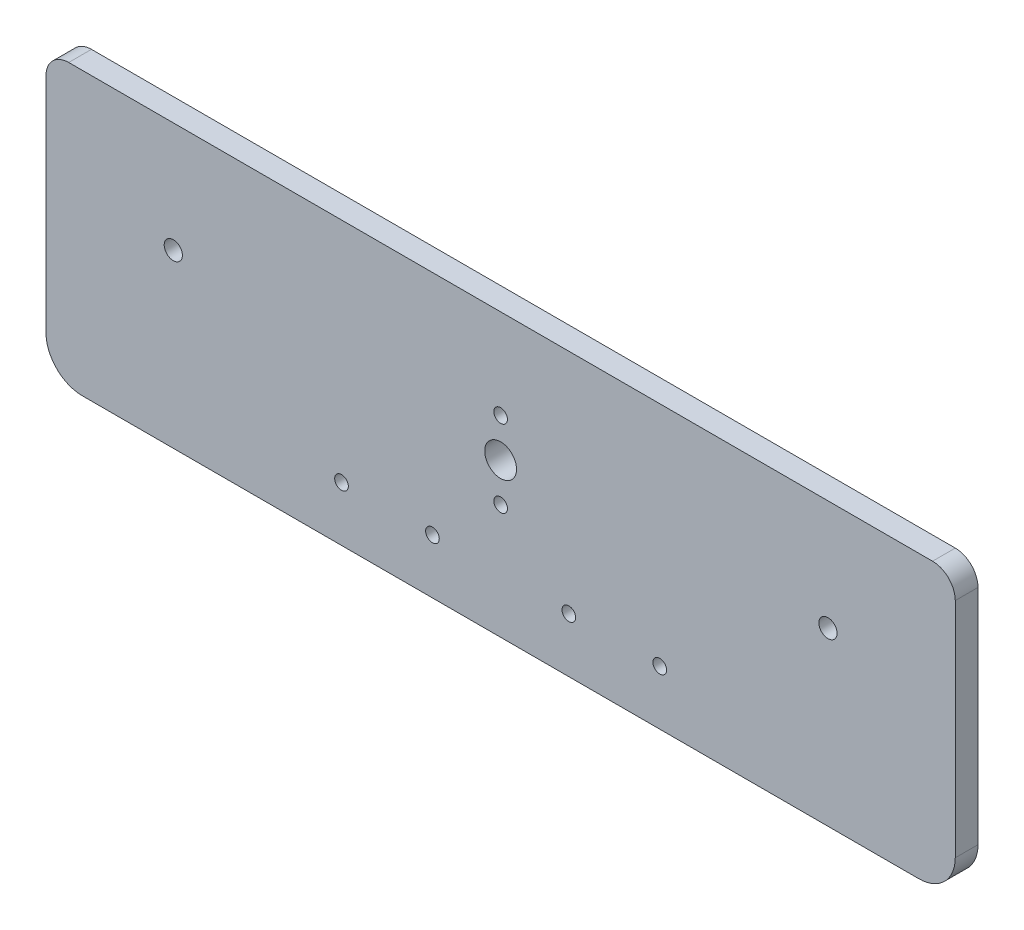
from build123d import *

# Parameters (mm, degrees)
CROQUIS1_R              = 1.5
CROQUIS1_R_2            = 2
CROQUIS1_R_3            = 3.5
SALIENTE_EXTRUIR1_DEPTH = 5
REDONDEO1_R             = 5
CROQUIS2_R              = 1.5
CORTAR_EXTRUIR1_DEPTH   = 116.212846506


with BuildPart() as part:
    # Croquis1 → Saliente-Extruir1 (new body)
    with BuildSketch(Plane.XY):
        with BuildLine():
            Line((100, -49), (100, 0))
            Line((100, 0), (100, 5))
            Line((100, 5), (-100, 5))
            Line((-100, 5), (-100, 0))
            Line((-100, 0), (-100, -49))
            ThreePointArc((-100, -49), (-97.656854249, -54.656854249), (-92, -57))
            Line((-92, -57), (92, -57))
            ThreePointArc((92, -57), (97.656854249, -54.656854249), (100, -49))
        make_face()
        with Locations((-35, -45)):
            Circle(CROQUIS1_R, mode=Mode.SUBTRACT)
        with Locations((-15, -45)):
            Circle(CROQUIS1_R, mode=Mode.SUBTRACT)
        with Locations((15, -45)):
            Circle(CROQUIS1_R, mode=Mode.SUBTRACT)
        with Locations((35, -45)):
            Circle(CROQUIS1_R, mode=Mode.SUBTRACT)
        with Locations((-72, -19.25)):
            Circle(CROQUIS1_R_2, mode=Mode.SUBTRACT)
        with Locations((0, -23.25)):
            Circle(CROQUIS1_R_3, mode=Mode.SUBTRACT)
        with Locations((72, -19.25)):
            Circle(CROQUIS1_R_2, mode=Mode.SUBTRACT)
    extrude(amount=SALIENTE_EXTRUIR1_DEPTH)

    # Redondeo1
    redondeo1_edges = [part.edges().sort_by_distance(p)[0] for p in [
        (-100, 5, 2.5),
        (100, 5, 2.5),
    ]]
    fillet(redondeo1_edges, radius=REDONDEO1_R)

    # Croquis2 → Cortar-Extruir1 (cut, through all)
    with BuildSketch(Plane.XY.offset(5)):
        with Locations((0, -14.75)):
            Circle(CROQUIS2_R)
        with Locations((0, -31.75)):
            Circle(CROQUIS2_R)
    extrude(amount=-CORTAR_EXTRUIR1_DEPTH, mode=Mode.SUBTRACT)


solid = part.part
